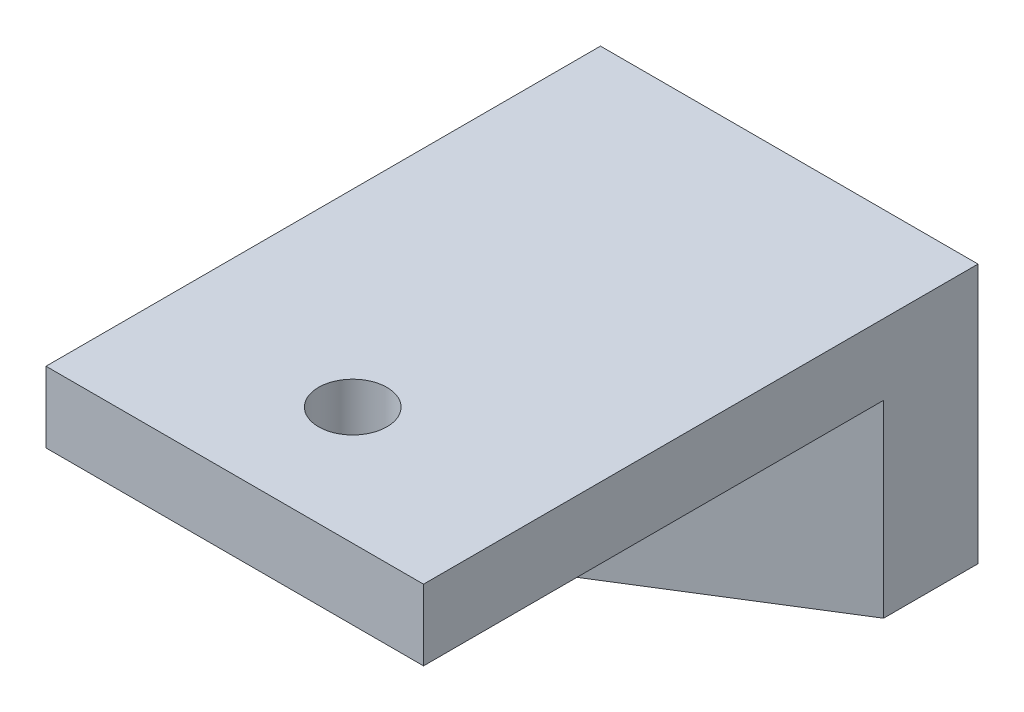
from build123d import *

# Parameters (mm, degrees)
BOSS_EXTRUDE1_DEPTH = 8
SKETCH2_W           = 16
SKETCH2_H           = 23.5
BOSS_EXTRUDE2_DEPTH = 3
SKETCH3_R           = 1.45
CUT_EXTRUDE1_DEPTH  = 3


with BuildPart() as part:
    # Sketch1 → Boss-Extrude1 (new body)
    with BuildSketch(Plane(origin=(0, 0, 0), x_dir=(1, 0, 0), z_dir=(0, 1, 0))):
        Polygon((-47.134549376, 16.069493776), (-47.134549376, 12.069493776), (-39.134549376, 7.069493776), (-31.134549376, 12.069493776), (-31.134549376, 16.069493776), (-39.134549376, 11.069493776), align=None)
    extrude(amount=BOSS_EXTRUDE1_DEPTH)

    # Sketch2 → Boss-Extrude2 (add)
    with BuildSketch(Plane(origin=(0, 8, 0), x_dir=(1, 0, 0), z_dir=(0, 1, 0))):
        with Locations((-39.134549376, 4.319493776)):
            Rectangle(SKETCH2_W, SKETCH2_H)
    extrude(amount=BOSS_EXTRUDE2_DEPTH)

    # Sketch3 → Cut-Extrude1 (cut)
    with BuildSketch(Plane(origin=(0, 11, 0), x_dir=(1, 0, 0), z_dir=(0, 1, 0))):
        with Locations(Location((-39.134549376, -2.430506224, 0), (0, 0, 270))):
            Circle(SKETCH3_R)
    extrude(amount=-CUT_EXTRUDE1_DEPTH, mode=Mode.SUBTRACT)


solid = part.part
